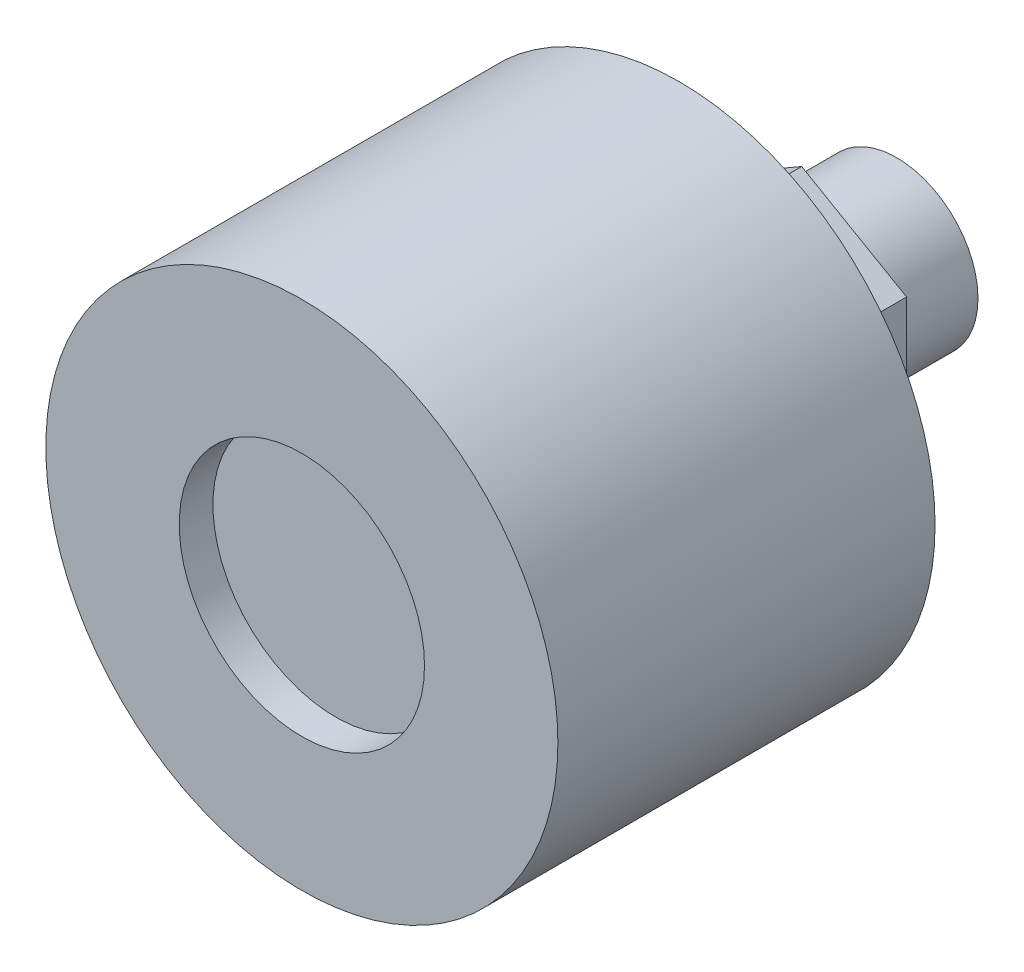
from build123d import *

# Parameters (mm, degrees)
BOSS_EXTRUDE1_DEPTH      = 1
BOSS_EXTRUDE1_DEPTH_BACK = 0.1
SKETCH3_R                = 8.35
SKETCH3_R_2              = 4
SKETCH4_R                = 8.35
BOSS_EXTRUDE2_DEPTH      = 11.2
BOSS_EXTRUDE4_DEPTH      = 4
SKETCH6_R                = 2.65
BOSS_EXTRUDE5_DEPTH      = 3.1
SKETCH7_R                = 0.244312337
CUT_EXTRUDE1_DEPTH       = 2


with BuildPart() as part:
    # Sketch3 → Boss-Extrude1 (new, two sides: drawn at the far end of the back side and taken through both)
    with BuildSketch(Plane.XY.offset(-BOSS_EXTRUDE1_DEPTH_BACK)):
        Circle(SKETCH3_R)
        Circle(SKETCH3_R_2, mode=Mode.SUBTRACT)
    extrude(amount=BOSS_EXTRUDE1_DEPTH + BOSS_EXTRUDE1_DEPTH_BACK)

    # Sketch4 → Boss-Extrude2 (add)
    with BuildSketch(Plane(origin=(0, 0, -0.1), x_dir=(-1, 0, 0), z_dir=(0, 0, -1))):
        with Locations(Location((0, 0, 0), (0, 0, 180))):
            Circle(SKETCH4_R)
    extrude(amount=BOSS_EXTRUDE2_DEPTH)

    # Sketch5 → Boss-Extrude4 (add)
    with BuildSketch(Plane(origin=(0, 0, -11.3), x_dir=(-1, 0, 0), z_dir=(0, 0, -1))):
        Polygon((0, 3.95), (-3.420800345, 1.975), (-3.420800345, -1.975), (0, -3.95), (3.420800345, -1.975), (3.420800345, 1.975), align=None)
    extrude(amount=BOSS_EXTRUDE4_DEPTH)

    # Sketch6 → Boss-Extrude5 (add)
    with BuildSketch(Plane(origin=(0, 0, -15.3), x_dir=(-1, 0, 0), z_dir=(0, 0, -1))):
        with Locations(Location((0, 0, 0), (0, 0, 180))):
            Circle(SKETCH6_R)
    extrude(amount=BOSS_EXTRUDE5_DEPTH)

    # Sketch7 → Cut-Extrude1 (cut)
    with BuildSketch(Plane(origin=(0, 0, -18.4), x_dir=(-1, 0, 0), z_dir=(0, 0, -1))):
        Circle(SKETCH7_R)
    extrude(amount=-CUT_EXTRUDE1_DEPTH, mode=Mode.SUBTRACT)


solid = part.part
